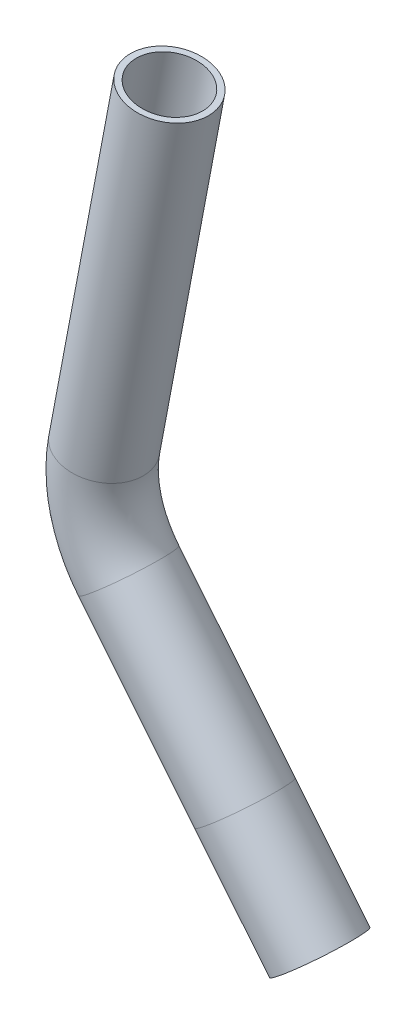
from build123d import *

# Parameters (mm, degrees)
SKETCH_2_R   = 3.35
SKETCH_2_R_2 = 2.85


with BuildPart() as part:
    # По траектории1: sweep along a path in Эскиз1
    with BuildLine(Plane.XY) as sweep_1_path:
        Line((-12.67059026, 57.046486939), (-18.171515217, 27.990319213))
        ThreePointArc((-18.171515217, 27.990319213), (-18.041069279, 23.679327915), (-16.107188295, 19.824231748))
        Line((-16.107188295, 19.824231748), (-6.305926251, 7.761140001))
        Line((-6.305926251, 7.761140001), (0, 0))
    # Эскиз2 → По траектории1 (sweep)
    with BuildSketch(Plane(origin=(0, 0, 0), x_dir=(-0.7761140001162656, -0.6305926250944656, 0), z_dir=(0.6305926250944656, -0.7761140001162656, 0))):
        Circle(SKETCH_2_R)
        Circle(SKETCH_2_R_2, mode=Mode.SUBTRACT)
    sweep(path=sweep_1_path.line)


solid = part.part
